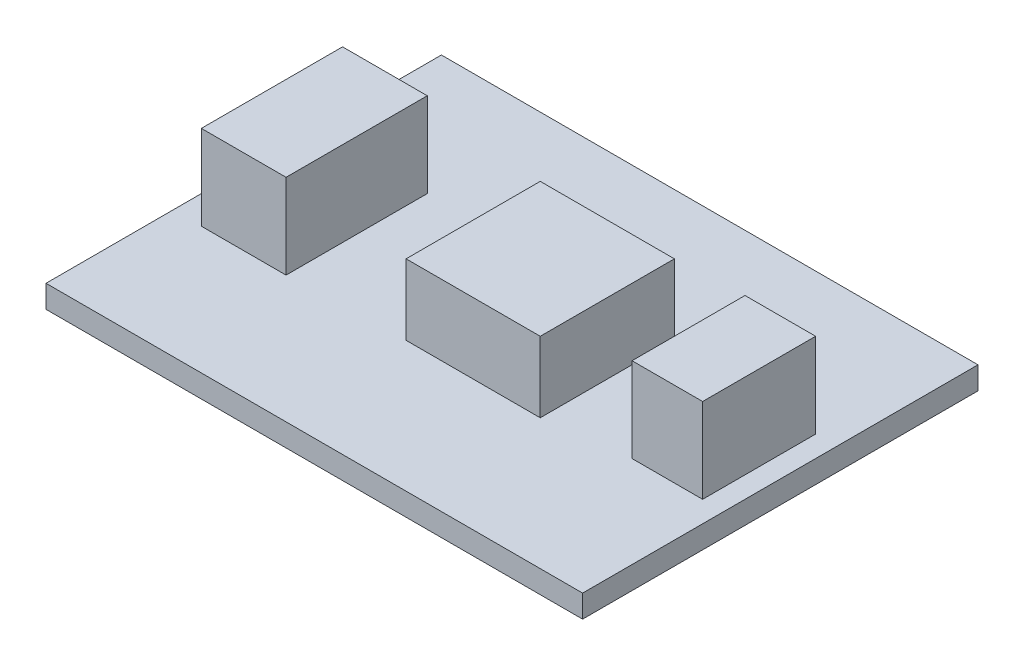
from build123d import *

# Parameters (mm, degrees)
SKETCH1_W             = 38
SKETCH1_H             = 28
BOARD_DEPTH           = 1.6
PROBE_CONNECTOR_START = 1.6
SKETCH2_W             = 6
SKETCH2_H             = 10
PROBE_CONNECTOR_DEPTH = 6
SIGNAL_HEADER_START   = 1.6
SKETCH3_W             = 5
SKETCH3_H             = 8
SIGNAL_HEADER_DEPTH   = 6
TRIM_POT_START        = 1.6
SKETCH4_W             = 9.5
SKETCH4_H             = 9.5
TRIM_POT_DEPTH        = 5


with BuildPart() as part:
    # Sketch1 → Board (new body)
    with BuildSketch(Plane(origin=(0, 0, 0), x_dir=(1, 0, 0), z_dir=(0, 1, 0))):
        Rectangle(SKETCH1_W, SKETCH1_H)
    extrude(amount=BOARD_DEPTH)

    # Sketch2 → Probe_Connector (add)
    with BuildSketch(Plane(origin=(0, 0, 0), x_dir=(1, 0, 0), z_dir=(0, 1, 0)).offset(PROBE_CONNECTOR_START)):
        with Locations((-14, 0)):
            Rectangle(SKETCH2_W, SKETCH2_H)
    extrude(amount=PROBE_CONNECTOR_DEPTH)

    # Sketch3 → Signal_Header (add)
    with BuildSketch(Plane(origin=(0, 0, 0), x_dir=(1, 0, 0), z_dir=(0, 1, 0)).offset(SIGNAL_HEADER_START)):
        with Locations((15, 0)):
            Rectangle(SKETCH3_W, SKETCH3_H)
    extrude(amount=SIGNAL_HEADER_DEPTH)

    # Sketch4 → Trim_Pot (add)
    with BuildSketch(Plane(origin=(0, 0, 0), x_dir=(1, 0, 0), z_dir=(0, 1, 0)).offset(TRIM_POT_START)):
        with Locations((2, 0)):
            Rectangle(SKETCH4_W, SKETCH4_H)
    extrude(amount=TRIM_POT_DEPTH)


solid = part.part
